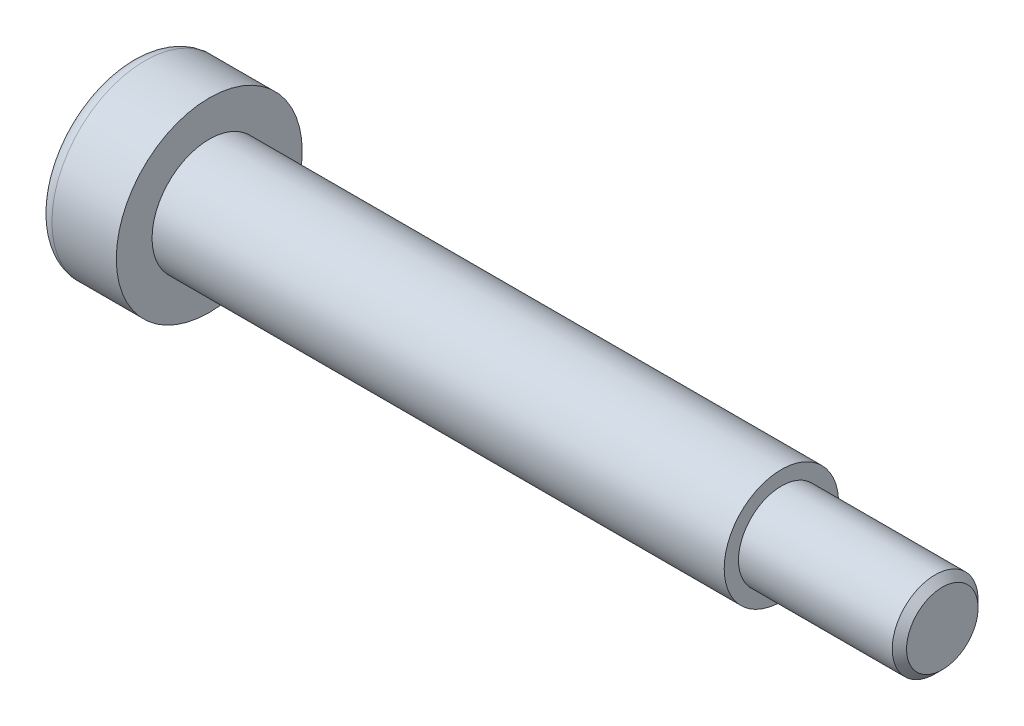
from build123d import *

# Parameters (mm, degrees)
CUT_EXTRUDE_1_DEPTH = 3.3
FILLET_1_R          = 1
CHAMFER_1_SIZE      = 0.5


with BuildPart() as part:
    # 草图1 → 旋转1 (revolve)
    with BuildSketch(Plane.XY, mode=Mode.PRIVATE) as revolve_1_sk:
        Polygon((0, 0), (0, 6.5), (5.5, 6.5), (5.5, 4), (45.5, 4), (45.5, 3), (56.75, 3), (56.75, 0), align=None)
    revolve(revolve_1_sk.sketch.rotate(Axis((0, 0, 0), (1, 0, 0)), 90), axis=Axis((0, 0, 0), (1, 0, 0)))

    # 草图2 → 切除-拉伸1 (cut)
    with BuildSketch(Plane.ZY):
        Polygon((0, 2.309401077), (-2, 1.154700538), (-2, -1.154700538), (0, -2.309401077), (2, -1.154700538), (2, 1.154700538), align=None)
    extrude(amount=-CUT_EXTRUDE_1_DEPTH, mode=Mode.SUBTRACT)

    # 圆角1
    fillet_1_edges = [part.edges().sort_by_distance(p)[0] for p in [
        (0, 0, -6.5),
    ]]
    fillet(fillet_1_edges, radius=FILLET_1_R)

    # 倒角1
    chamfer_1_edges = [part.edges().sort_by_distance(p)[0] for p in [
        (56.75, 0, -3),
    ]]
    chamfer(chamfer_1_edges, length=CHAMFER_1_SIZE)


solid = part.part
